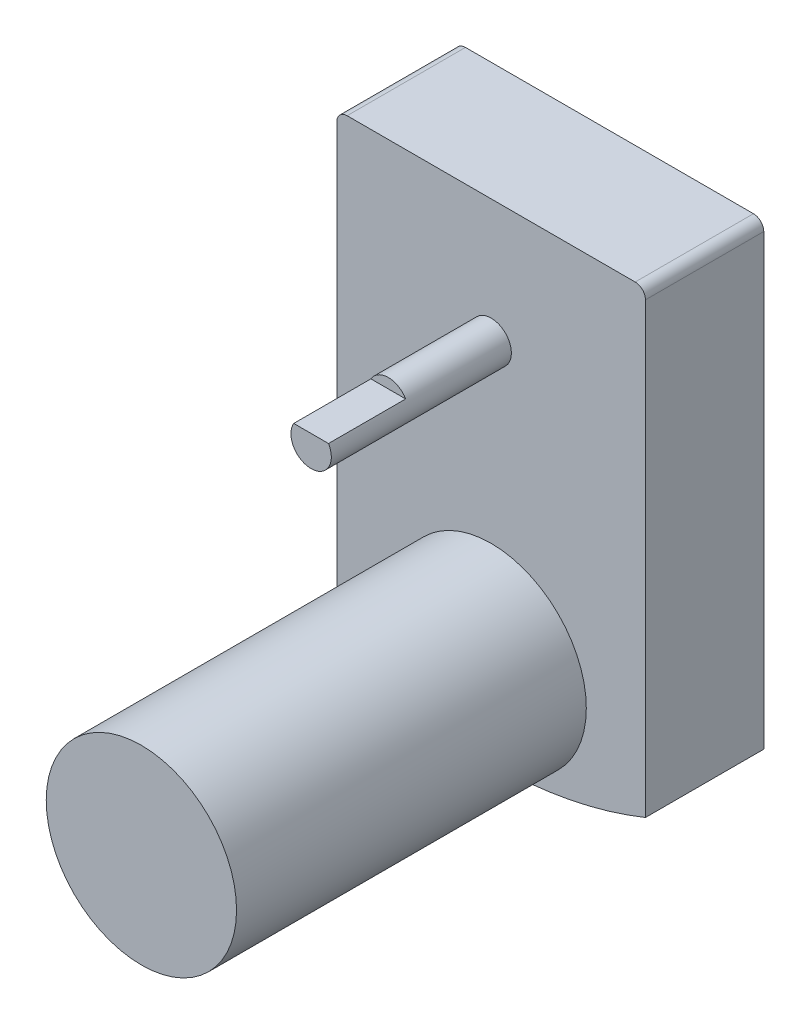
from build123d import *

# Parameters (mm, degrees)
SKETCH_3_W          = 60
SKETCH_3_H          = 95
EXTRUDE_1_DEPTH     = 23
SKETCH_4_R          = 18.5
EXTRUDE_2_DEPTH     = 68
SKETCH_5_R          = 3.927968391
EXTRUDE_3_DEPTH     = 35
CUT_EXTRUDE_4_DEPTH = 15
SKETCH_7_R          = 4
SKETCH_7_R_2        = 2
EXTRUDE_5_DEPTH     = 5
FILLET_1_R          = 2
FILLET_2_R          = 2
CUT_EXTRUDE_5_DEPTH = 18
CUT_EXTRUDE_6_DEPTH = 50


with BuildPart() as part:
    # 草图3 → 凸台-拉伸1 (new body)
    with BuildSketch(Plane.XY):
        Rectangle(SKETCH_3_W, SKETCH_3_H)
    extrude(amount=EXTRUDE_1_DEPTH)

    # 草图4 → 凸台-拉伸2 (add)
    with BuildSketch(Plane.XY.offset(23)):
        with Locations((0, -29)):
            Circle(SKETCH_4_R)
    extrude(amount=EXTRUDE_2_DEPTH)

    # 草图5 → 凸台-拉伸3 (add)
    with BuildSketch(Plane.XY.offset(23)):
        with Locations((0, 23.5)):
            Circle(SKETCH_5_R)
    extrude(amount=EXTRUDE_3_DEPTH)

    # 草图6 → 切除-拉伸4 (cut)
    with BuildSketch(Plane.XY.offset(58)):
        Polygon((-3.927968391, 25.5), (3.927968391, 25.5), (-0.421673312, 30.850225799), align=None)
    extrude(amount=-CUT_EXTRUDE_4_DEPTH, mode=Mode.SUBTRACT)

    # 草图7 → 凸台-拉伸5 (add)
    # profile 1 of 4: a face of its own
    with BuildSketch(Plane(origin=(0, 0, 0), x_dir=(-1, 0, 0), z_dir=(0, 0, -1))):
        with Locations((20, 23.5)):
            Circle(SKETCH_7_R)
        with Locations((20, 23.5)):
            Circle(SKETCH_7_R_2, mode=Mode.SUBTRACT)
    # profile 2 of 4: a face of its own
    with BuildSketch(Plane(origin=(0, 0, 0), x_dir=(-1, 0, 0), z_dir=(0, 0, -1))):
        with Locations((-20, 23.5)):
            Circle(SKETCH_7_R)
        with Locations((-20, 23.5)):
            Circle(SKETCH_7_R_2, mode=Mode.SUBTRACT)
    # profile 3 of 4: a face of its own
    with BuildSketch(Plane(origin=(0, 0, 0), x_dir=(-1, 0, 0), z_dir=(0, 0, -1))):
        with Locations((20, -16.5)):
            Circle(SKETCH_7_R)
        with Locations((20, -16.5)):
            Circle(SKETCH_7_R_2, mode=Mode.SUBTRACT)
    # profile 4 of 4: a face of its own
    with BuildSketch(Plane(origin=(0, 0, 0), x_dir=(-1, 0, 0), z_dir=(0, 0, -1))):
        with Locations((-20, -16.5)):
            Circle(SKETCH_7_R)
        with Locations((-20, -16.5)):
            Circle(SKETCH_7_R_2, mode=Mode.SUBTRACT)
    extrude(amount=EXTRUDE_5_DEPTH)

    # 圆角1
    fillet_1_edges = [part.edges().sort_by_distance(p)[0] for p in [
        (-30, 47.5, 11.5),
    ]]
    fillet(fillet_1_edges, radius=FILLET_1_R)

    # 圆角2
    fillet_2_edges = [part.edges().sort_by_distance(p)[0] for p in [
        (30, 47.5, 11.5),
    ]]
    fillet(fillet_2_edges, radius=FILLET_2_R)

    # 草图8 → 切除-拉伸5 (cut)
    with BuildSketch(Plane(origin=(0, 0, 0), x_dir=(-1, 0, 0), z_dir=(0, 0, -1))):
        with BuildLine():
            Line((-58.103479581, -22.49077796), (-70.696713814, -61.415320137))
            Line((-70.696713814, -61.415320137), (7.471875411, -106.902176459))
            Line((7.471875411, -106.902176459), (82.773645961, -42.112074387))
            Line((82.773645961, -42.112074387), (69.369579427, -7.347979247))
            ThreePointArc((69.369579427, -7.347979247), (9.437019638, -46.941441706), (-58.103479581, -22.49077796))
        make_face()
    extrude(amount=-CUT_EXTRUDE_5_DEPTH, mode=Mode.SUBTRACT)

    # 草图8<2> → 切除-拉伸6 (cut)
    with BuildSketch(Plane(origin=(0, 0, 0), x_dir=(-1, 0, 0), z_dir=(0, 0, -1))):
        with BuildLine():
            Line((-58.103479581, -22.49077796), (-70.696713814, -61.415320137))
            Line((-70.696713814, -61.415320137), (7.471875411, -106.902176459))
            Line((7.471875411, -106.902176459), (82.773645961, -42.112074387))
            Line((82.773645961, -42.112074387), (69.369579427, -7.347979247))
            ThreePointArc((69.369579427, -7.347979247), (9.437019638, -46.941441706), (-58.103479581, -22.49077796))
        make_face()
    extrude(amount=-CUT_EXTRUDE_6_DEPTH, mode=Mode.SUBTRACT)


solid = part.part
